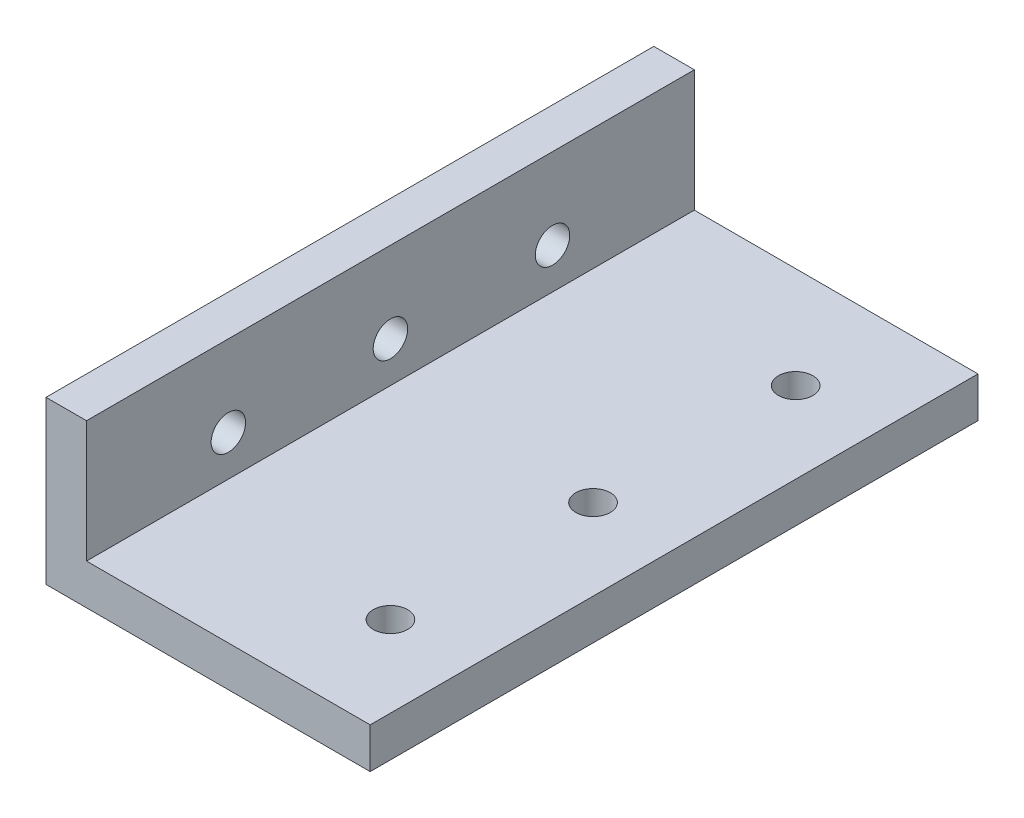
from build123d import *

# Parameters (mm, degrees)
EXTRUDE_1_DEPTH                   = 150
HOLE_WIZARD_8_5_8_5_1_D           = 8.5
HOLE_WIZARD_8_5_8_5_1_ON_FACE_2_D = 8.5


with BuildPart() as part:
    # 草图1 → 凸台-拉伸1 (new body)
    with BuildSketch(Plane.XY):
        Polygon((0, 40), (0, 0), (80, 0), (80, 10), (10, 10), (10, 40), align=None)
    extrude(amount=EXTRUDE_1_DEPTH)

    # Ø8.5 (8.5) 直径孔1 (through all)
    with Locations(Plane(origin=(10, 20, 115), x_dir=(0, 0, 1), z_dir=(1, 0, 0))):
        with Locations((0, 0), (-80, 0), (-40, 0)):
            Hole(HOLE_WIZARD_8_5_8_5_1_D / 2)

    # Ø8.5 (8.5) 直径孔1 on face 2 (through all)
    with Locations(Plane(origin=(60, 10, 125), x_dir=(0, 0, 1), z_dir=(0, 1, 0))):
        with Locations((0, 0), (-100, 0), (-50, 0)):
            Hole(HOLE_WIZARD_8_5_8_5_1_ON_FACE_2_D / 2)


solid = part.part
